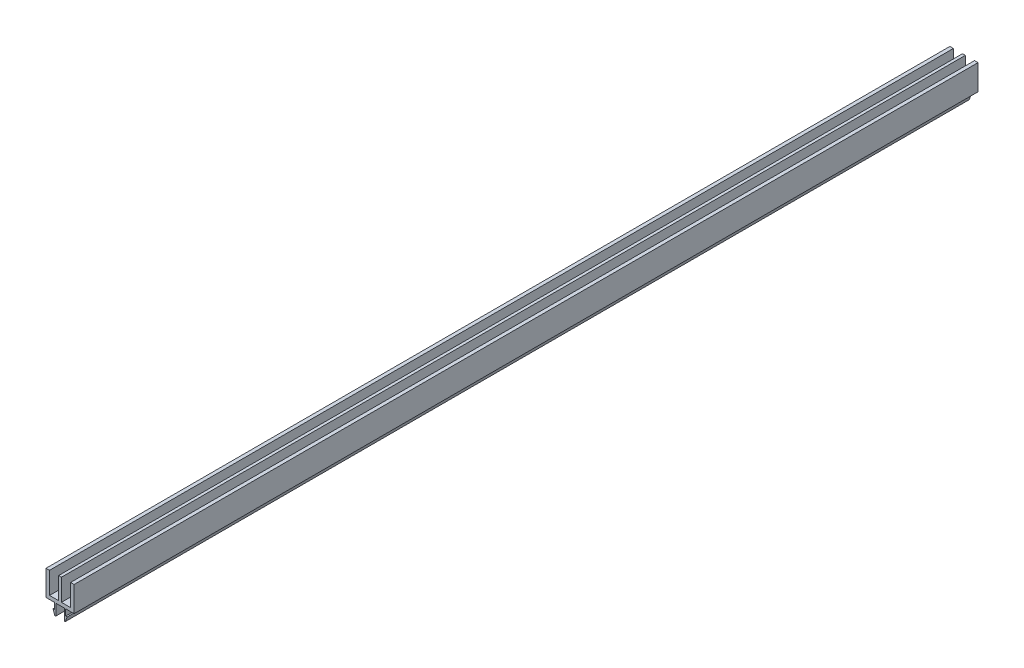
from build123d import *

# Parameters (mm, degrees)
BOSS_EXTRU_1_DEPTH = 643.09


with BuildPart() as part:
    # Esquisse1 → Boss.-Extru.1 (new body)
    with BuildSketch(Plane.XY.offset(50)):
        Polygon((-1, 2.5), (-7.5, 2.5), (-7.5, 17.999999998), (-10, 17.999999998), (-10, 0), (-4, 0), (-4, -4.5), (-5, -4.5), (-3.75, -8), (-3, -8), (-3, 0), (3, 0), (3, -8), (3.75, -8), (5, -4.5), (4, -4.5), (4, 0), (10, 0), (10, 17.999999998), (7.5, 17.999999998), (7.5, 2.5), (1, 2.5), (1, 17.999999998), (-1, 17.999999998), align=None)
    extrude(amount=-BOSS_EXTRU_1_DEPTH)


solid = part.part
